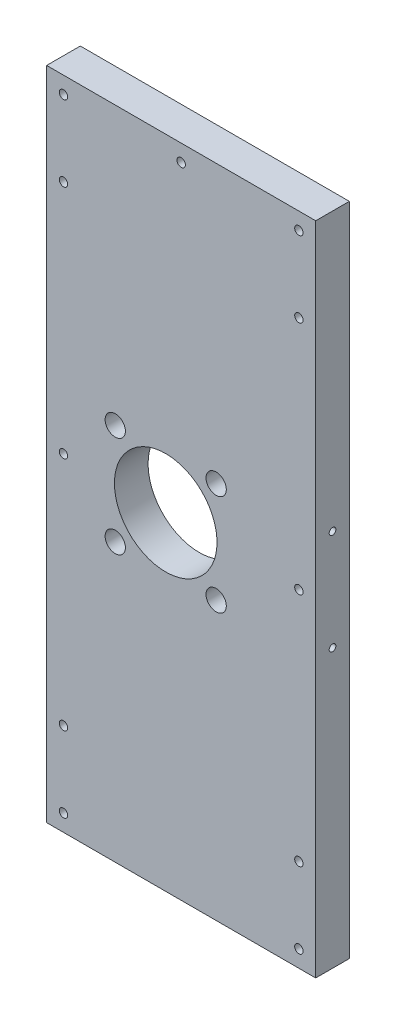
from build123d import *

# Parameters (mm, degrees)
SKIZZE1_W                       = 80
SKIZZE1_H                       = 195
AUFSATZ_LINEAR_AUSTRAGEN1_DEPTH = 10
SKIZZE2_R                       = 3.015
SKIZZE2_R_2                     = 15.25
SCHNITT_LINEAR_AUSTRAGEN1_DEPTH = 10
SKIZZE3_R                       = 2.5
SCHNITT_LINEAR_AUSTRAGEN2_DEPTH = 5
SKIZZE6_R                       = 1.25
SCHNITT_LINEAR_AUSTRAGEN4_DEPTH = 5
SKIZZE7_R                       = 1
SCHNITT_LINEAR_AUSTRAGEN5_DEPTH = 20
SCHNITT_LINEAR_START            = -30
SKIZZE8_R                       = 1
SCHNITT_LINEAR_AUSTRAGEN6_DEPTH = 30


with BuildPart() as part:
    # Skizze1 → Aufsatz-Linear austragen1 (new body)
    with BuildSketch(Plane.XY):
        with Locations((-29.059385344, -27.400468384)):
            Rectangle(SKIZZE1_W, SKIZZE1_H)
    extrude(amount=-AUFSATZ_LINEAR_AUSTRAGEN1_DEPTH)

    # Skizze2 → Schnitt-Linear austragen1 (cut)
    with BuildSketch(Plane(origin=(0, 0, -10), x_dir=(-1, 0, 0), z_dir=(0, 0, -1))):
        with Locations((18.659385344, -12.400468384)):
            Circle(SKIZZE2_R)
        with Locations((48.659385344, -12.400468384)):
            Circle(SKIZZE2_R)
        with Locations((18.659385344, -42.400468384)):
            Circle(SKIZZE2_R)
        with Locations((48.659385344, -42.400468384)):
            Circle(SKIZZE2_R)
        with Locations((33.659385344, -27.400468384)):
            Circle(SKIZZE2_R_2)
    extrude(amount=-SCHNITT_LINEAR_AUSTRAGEN1_DEPTH, mode=Mode.SUBTRACT)

    # Skizze3 → Schnitt-Linear austragen2 (cut)
    with BuildSketch(Plane(origin=(0, 0, -10), x_dir=(-1, 0, 0), z_dir=(0, 0, -1))):
        with Locations((29.059385344, 65.099531616)):
            Circle(SKIZZE3_R)
        with Locations((-5.940614656, 65.099531616)):
            Circle(SKIZZE3_R)
        with Locations((64.059385344, 65.099531616)):
            Circle(SKIZZE3_R)
        with Locations((29.059385344, -119.900468384)):
            Circle(SKIZZE3_R)
        with Locations((-5.940614656, -119.900468384)):
            Circle(SKIZZE3_R)
        with Locations((64.059385344, -119.900468384)):
            Circle(SKIZZE3_R)
        with Locations((-5.940614656, 42.599531616)):
            Circle(SKIZZE3_R)
        with Locations((-5.940614656, -27.400468384)):
            Circle(SKIZZE3_R)
        with Locations((-5.940614656, -97.400468384)):
            Circle(SKIZZE3_R)
        with Locations((64.059385344, -97.400468384)):
            Circle(SKIZZE3_R)
        with Locations((64.059385344, -27.400468384)):
            Circle(SKIZZE3_R)
        with Locations((64.059385344, 42.599531616)):
            Circle(SKIZZE3_R)
    extrude(amount=-SCHNITT_LINEAR_AUSTRAGEN2_DEPTH, mode=Mode.SUBTRACT)

    # Skizze6 → Schnitt-Linear austragen4 (cut)
    with BuildSketch(Plane.XY):
        with Locations((-64.059385344, 65.099531616)):
            Circle(SKIZZE6_R)
        with Locations((-29.059385344, 65.099531616)):
            Circle(SKIZZE6_R)
        with Locations((5.940614656, 65.099531616)):
            Circle(SKIZZE6_R)
        with Locations((-64.059385344, 42.599531616)):
            Circle(SKIZZE6_R)
        with Locations((-64.059385344, -27.400468384)):
            Circle(SKIZZE6_R)
        with Locations((-64.059385344, -97.400468384)):
            Circle(SKIZZE6_R)
        with Locations((-64.059385344, -119.900468384)):
            Circle(SKIZZE6_R)
        with Locations((5.940614656, -119.900468384)):
            Circle(SKIZZE6_R)
        with Locations((5.940614656, -97.400468384)):
            Circle(SKIZZE6_R)
        with Locations((5.940614656, -27.400468384)):
            Circle(SKIZZE6_R)
        with Locations((5.940614656, 42.599531616)):
            Circle(SKIZZE6_R)
    extrude(amount=-SCHNITT_LINEAR_AUSTRAGEN4_DEPTH, mode=Mode.SUBTRACT)

    # Skizze7 → Schnitt-Linear austragen5 (cut)
    with BuildSketch(Plane.ZY.offset(69.059385344)):
        with Locations((-5, -12.400468384)):
            Circle(SKIZZE7_R)
        with Locations((-5, -42.400468384)):
            Circle(SKIZZE7_R)
    extrude(amount=-SCHNITT_LINEAR_AUSTRAGEN5_DEPTH, mode=Mode.SUBTRACT)

    # Skizze8 → Schnitt-Linear austragen6 (cut)
    with BuildSketch(Plane(origin=(10.940614656, 0, 0), x_dir=(0, 0, -1), z_dir=(1, 0, 0)).offset(SCHNITT_LINEAR_START)):
        with Locations(Location((5, -12.400468384, 0), (0, 0, 180))):
            Circle(SKIZZE8_R)
        with Locations(Location((5, -42.400468384, 0), (0, 0, 180))):
            Circle(SKIZZE8_R)
    extrude(amount=SCHNITT_LINEAR_AUSTRAGEN6_DEPTH, mode=Mode.SUBTRACT)


solid = part.part
